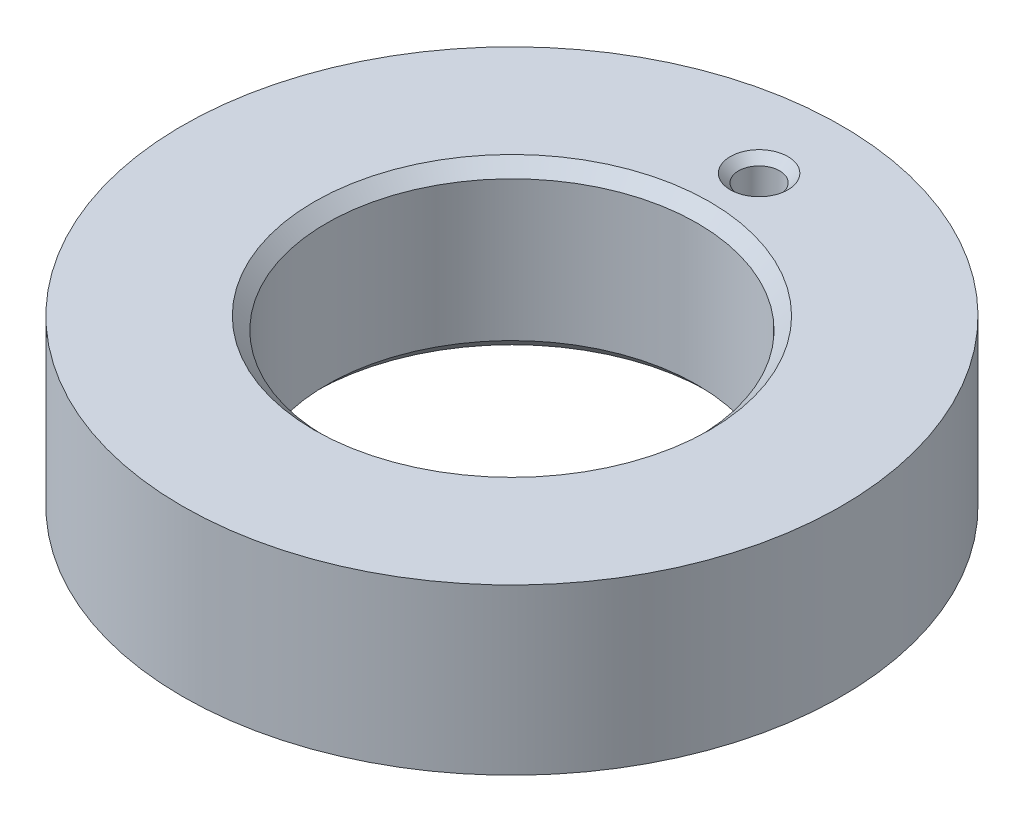
from build123d import *

# Parameters (mm, degrees)
SKETCH_1_R            = 40
EXTRUDE_1_DEPTH       = 20
SKETCH_2_R            = 22.5
CUT_EXTRUDE_1_DEPTH   = 61
CHAMFER_1_SIZE        = 1.5
SKETCH_3_R            = 2.5
CUT_EXTRUDE_597_DEPTH = 61
CHAMFER_2_SIZE        = 1


with BuildPart() as part:
    # Эскиз1 → Бобышка-Вытянуть1 (new body)
    with BuildSketch(Plane(origin=(0, 0, 0), x_dir=(1, 0, 0), z_dir=(0, 1, 0))):
        with Locations(Location((0, 0, 0), (0, 0, 270))):
            Circle(SKETCH_1_R)
    extrude(amount=EXTRUDE_1_DEPTH)

    # Эскиз2 → Вырез-Вытянуть1 (cut, through all)
    with BuildSketch(Plane(origin=(0, 20, 0), x_dir=(1, 0, 0), z_dir=(0, 1, 0))):
        with Locations(Location((0, 0, 0), (0, 0, 270))):
            Circle(SKETCH_2_R)
    extrude(amount=-CUT_EXTRUDE_1_DEPTH, mode=Mode.SUBTRACT)

    # Фаска1
    chamfer_1_edges = [part.edges().sort_by_distance(p)[0] for p in [
        (0, 0, -22.5),
        (0, 20, -22.5),
    ]]
    chamfer(chamfer_1_edges, length=CHAMFER_1_SIZE)

    # Эскиз3 → Cut-Extrude 597 (cut, through all)
    with BuildSketch(Plane.XZ):
        with Locations(Location((0, -30, 0), (0, 0, 270))):
            Circle(SKETCH_3_R)
    extrude(amount=-CUT_EXTRUDE_597_DEPTH, mode=Mode.SUBTRACT)

    # Фаска2
    chamfer_2_edges = [part.edges().sort_by_distance(p)[0] for p in [
        (0, 20, -27.5),
        (0, 0, -27.5),
    ]]
    chamfer(chamfer_2_edges, length=CHAMFER_2_SIZE)


solid = part.part
